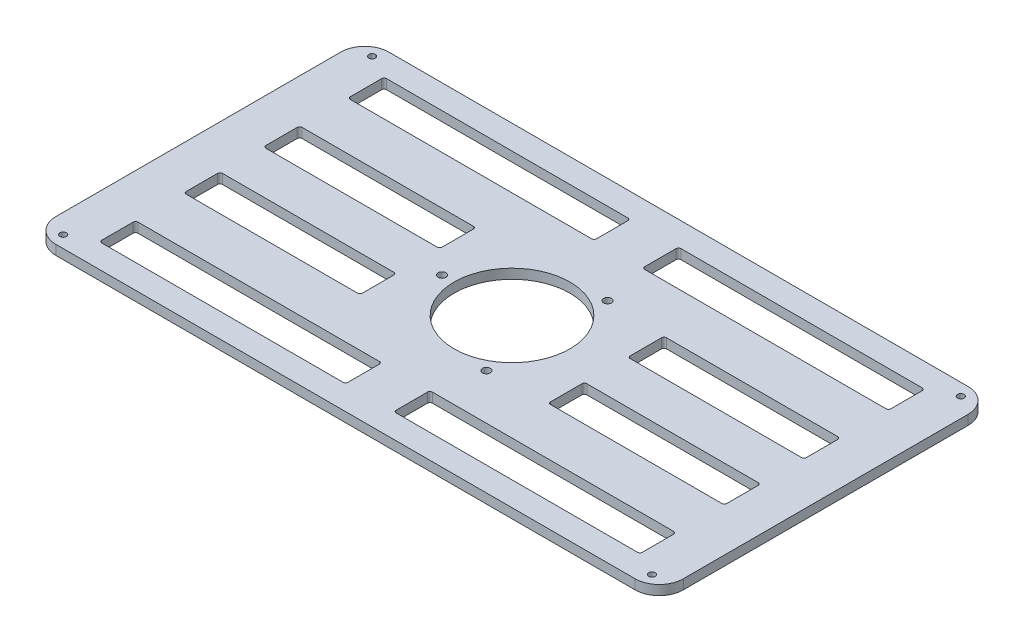
from build123d import *

# Parameters (mm, degrees)
SKETCH_1_W          = 260
SKETCH_1_H          = 138
SKETCH_1_R          = 1.35
EXTRUDE_1_DEPTH     = 4
SKETCH_3_R          = 24
SKETCH_3_R_2        = 1.65
CUT_EXTRUDE_1_DEPTH = 4
CUT_EXTRUDE_3_DEPTH = 4
FILLET_1_R          = 10


with BuildPart() as part:
    # 草图1 → 凸台-拉伸1 (new body)
    with BuildSketch(Plane(origin=(0, 0, 0), x_dir=(1, 0, 0), z_dir=(0, 1, 0))):
        Rectangle(SKETCH_1_W, SKETCH_1_H)
        with Locations(Location((-122, 64, 0), (0, 0, 270))):
            Circle(SKETCH_1_R, mode=Mode.SUBTRACT)
        with Locations(Location((122, 64, 0), (0, 0, 90))):
            Circle(SKETCH_1_R, mode=Mode.SUBTRACT)
        with Locations(Location((122, -64, 0), (0, 0, 270))):
            Circle(SKETCH_1_R, mode=Mode.SUBTRACT)
        with Locations(Location((-122, -64, 0), (0, 0, 90))):
            Circle(SKETCH_1_R, mode=Mode.SUBTRACT)
    extrude(amount=EXTRUDE_1_DEPTH)

    # 草图3 → 切除-拉伸1 (cut)
    with BuildSketch(Plane(origin=(0, 4, 0), x_dir=(1, 0, 0), z_dir=(0, 1, 0))):
        with Locations(Location((0, 0, 0), (0, 0, 270))):
            Circle(SKETCH_3_R)
        with Locations(Location((-29, 0, 0), (0, 0, 270))):
            Circle(SKETCH_3_R_2)
        with Locations(Location((14.5, 25.11473671, 0), (0, 0, 270))):
            Circle(SKETCH_3_R_2)
        with Locations(Location((14.5, -25.11473671, 0), (0, 0, 270))):
            Circle(SKETCH_3_R_2)
    extrude(amount=-CUT_EXTRUDE_1_DEPTH, mode=Mode.SUBTRACT)

    # 草图4 → 切除-拉伸3 (cut)
    with BuildSketch(Plane(origin=(0, 4, 0), x_dir=(1, 0, 0), z_dir=(0, 1, 0))):
        with BuildLine():
            Line((-111, 59), (-11, 59))
            ThreePointArc((-11, 59), (-10.292893219, 58.707106781), (-10, 58))
            Line((-10, 58), (-10, 45))
            ThreePointArc((-10, 45), (-10.292893219, 44.292893219), (-11, 44))
            Line((-11, 44), (-111, 44))
            ThreePointArc((-111, 44), (-111.707106781, 44.292893219), (-112, 45))
            Line((-112, 45), (-112, 58))
            ThreePointArc((-112, 58), (-111.707106781, 58.707106781), (-111, 59))
        make_face()
        with BuildLine():
            Line((-111, 24), (-40, 24))
            ThreePointArc((-40, 24), (-39.292893219, 23.707106781), (-39, 23))
            Line((-39, 23), (-39, 10))
            ThreePointArc((-39, 10), (-39.292893219, 9.292893219), (-40, 9))
            Line((-40, 9), (-111, 9))
            ThreePointArc((-111, 9), (-111.707106781, 9.292893219), (-112, 10))
            Line((-112, 10), (-112, 23))
            ThreePointArc((-112, 23), (-111.707106781, 23.707106781), (-111, 24))
        make_face()
        with BuildLine():
            Line((111, 9), (40, 9))
            ThreePointArc((40, 9), (39.292893219, 9.292893219), (39, 10))
            Line((39, 10), (39, 23))
            ThreePointArc((39, 23), (39.292893219, 23.707106781), (40, 24))
            Line((40, 24), (111, 24))
            ThreePointArc((111, 24), (111.707106781, 23.707106781), (112, 23))
            Line((112, 23), (112, 10))
            ThreePointArc((112, 10), (111.707106781, 9.292893219), (111, 9))
        make_face()
        with BuildLine():
            Line((111, 44), (11, 44))
            ThreePointArc((11, 44), (10.292893219, 44.292893219), (10, 45))
            Line((10, 45), (10, 58))
            ThreePointArc((10, 58), (10.292893219, 58.707106781), (11, 59))
            Line((11, 59), (111, 59))
            ThreePointArc((111, 59), (111.707106781, 58.707106781), (112, 58))
            Line((112, 58), (112, 45))
            ThreePointArc((112, 45), (111.707106781, 44.292893219), (111, 44))
        make_face()
        with BuildLine():
            Line((111, -9), (40, -9))
            ThreePointArc((40, -9), (39.292893219, -9.292893219), (39, -10))
            Line((39, -10), (39, -23))
            ThreePointArc((39, -23), (39.292893219, -23.707106781), (40, -24))
            Line((40, -24), (111, -24))
            ThreePointArc((111, -24), (111.707106781, -23.707106781), (112, -23))
            Line((112, -23), (112, -10))
            ThreePointArc((112, -10), (111.707106781, -9.292893219), (111, -9))
        make_face()
        with BuildLine():
            Line((-111, -9), (-40, -9))
            ThreePointArc((-40, -9), (-39.292893219, -9.292893219), (-39, -10))
            Line((-39, -10), (-39, -23))
            ThreePointArc((-39, -23), (-39.292893219, -23.707106781), (-40, -24))
            Line((-40, -24), (-111, -24))
            ThreePointArc((-111, -24), (-111.707106781, -23.707106781), (-112, -23))
            Line((-112, -23), (-112, -10))
            ThreePointArc((-112, -10), (-111.707106781, -9.292893219), (-111, -9))
        make_face()
        with BuildLine():
            Line((111, -44), (11, -44))
            ThreePointArc((11, -44), (10.292893219, -44.292893219), (10, -45))
            Line((10, -45), (10, -58))
            ThreePointArc((10, -58), (10.292893219, -58.707106781), (11, -59))
            Line((11, -59), (111, -59))
            ThreePointArc((111, -59), (111.707106781, -58.707106781), (112, -58))
            Line((112, -58), (112, -45))
            ThreePointArc((112, -45), (111.707106781, -44.292893219), (111, -44))
        make_face()
        with BuildLine():
            Line((-111, -44), (-11, -44))
            ThreePointArc((-11, -44), (-10.292893219, -44.292893219), (-10, -45))
            Line((-10, -45), (-10, -58))
            ThreePointArc((-10, -58), (-10.292893219, -58.707106781), (-11, -59))
            Line((-11, -59), (-111, -59))
            ThreePointArc((-111, -59), (-111.707106781, -58.707106781), (-112, -58))
            Line((-112, -58), (-112, -45))
            ThreePointArc((-112, -45), (-111.707106781, -44.292893219), (-111, -44))
        make_face()
    extrude(amount=-CUT_EXTRUDE_3_DEPTH, mode=Mode.SUBTRACT)

    # 圆角1
    fillet_1_edges = [part.edges().sort_by_distance(p)[0] for p in [
        (130, 2, 69),
        (-130, 2, 69),
        (-130, 2, -69),
        (130, 2, -69),
    ]]
    fillet(fillet_1_edges, radius=FILLET_1_R)


solid = part.part
